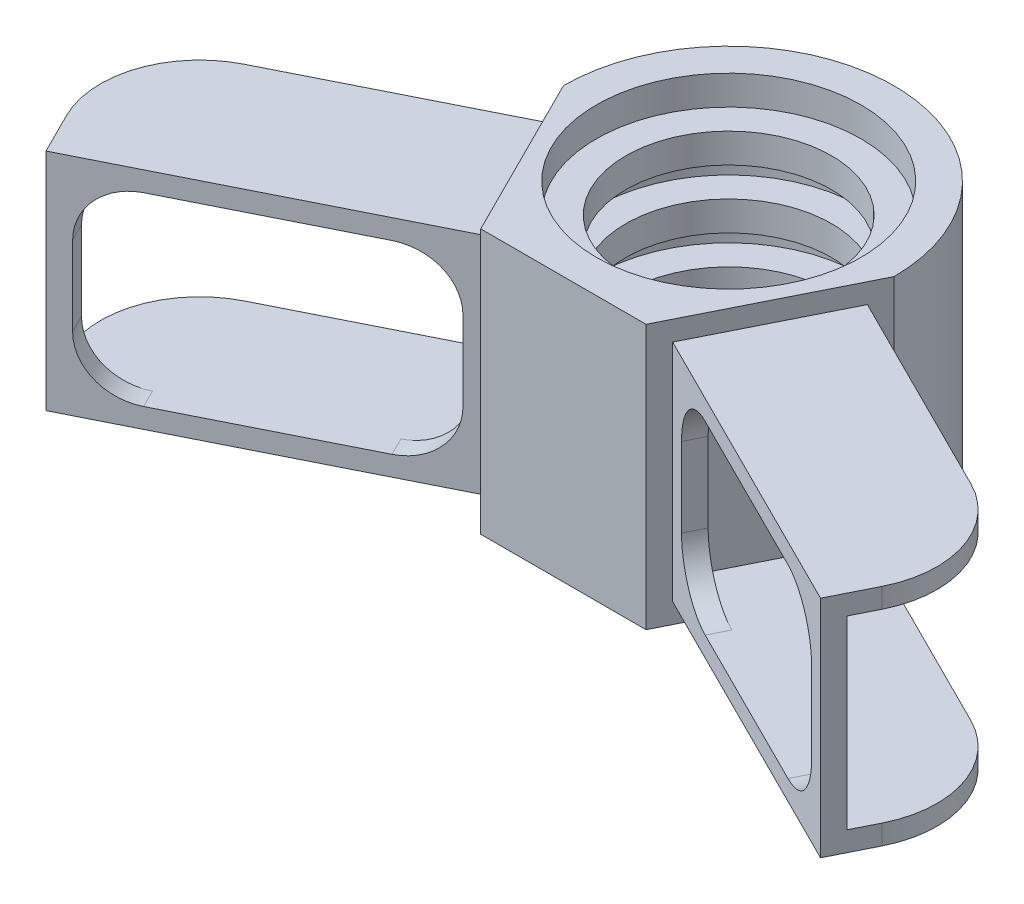
from build123d import *

# Parameters (mm, degrees)
EXTRUDE_1_DEPTH        = 40
EXTRUDE_2_DEPTH        = 50
FILLET_1_R             = 15
CUT_EXTRUDE_1_DEPTH    = 50
FILLET_1_OF_MIRROR_2_R = 15
SKETCH_4_R             = 20
CUT_EXTRUDE_2_DEPTH    = 4.444444444
SKETCH_5_R             = 15.555555556
CUT_EXTRUDE_3_DEPTH    = 86.214294565
PATTERN_LINEAR_1_COUNT = 5
PATTERN_LINEAR_1_PITCH = 8.888888889


with BuildPart() as part:
    # 草图1 → 凸台-拉伸1 (new body)
    with BuildSketch(Plane(origin=(0, 0, 0), x_dir=(1, 0, 0), z_dir=(0, 1, 0))):
        with BuildLine():
            Line((-25, 0), (-12.5, -25))
            Line((-12.5, -25), (12.5, -25))
            Line((12.5, -25), (25, 0))
            ThreePointArc((25, 0), (0, 25), (-25, 0))
        make_face()
    extrude(amount=EXTRUDE_1_DEPTH)

    # 草图2 → 凸台-拉伸2 (add)
    with BuildSketch(Plane(origin=(20, 0, 10), x_dir=(0.447213595499958, 0, -0.894427190999916), z_dir=(0.894427190999916, 0, 0.447213595499958))):
        Polygon((8.180339887, 34), (8.180339887, 37), (-13.770509831, 37), (-13.770509831, 3), (8.180339887, 3), (8.180339887, 6), (-10.770509831, 6), (-10.770509831, 34), align=None)
    extrude_2 = extrude(amount=EXTRUDE_2_DEPTH)

    # 圆角1
    fillet_1_edges = [part.edges().sort_by_distance(p)[0] for p in [
        (68.379718763, 35.5, 25.043961348),
        (68.379718763, 4.5, 25.043961348),
    ]]
    fillet(fillet_1_edges, radius=FILLET_1_R)

    # 草图3 → 切除-拉伸1 (cut)
    with BuildSketch(Plane(origin=(-6.158359214, 0, 12.316718427), x_dir=(0.8944271909999159, 0, 0.44721359549995804), z_dir=(-0.44721359549995804, 0, 0.8944271909999159))):
        with BuildLine():
            Line((25.360679775, 26), (25.360679775, 14))
            ThreePointArc((25.360679775, 14), (27.703825526, 8.343145751), (33.360679775, 6))
            Line((33.360679775, 6), (61.360679775, 6))
            ThreePointArc((61.360679775, 6), (67.017534024, 8.343145751), (69.360679775, 14))
            Line((69.360679775, 14), (69.360679775, 26))
            ThreePointArc((69.360679775, 26), (67.017534024, 31.656854249), (61.360679775, 34))
            Line((61.360679775, 34), (33.360679775, 34))
            ThreePointArc((33.360679775, 34), (27.703825526, 31.656854249), (25.360679775, 26))
        make_face()
    cut_extrude_1 = extrude(amount=-CUT_EXTRUDE_1_DEPTH, mode=Mode.SUBTRACT)

    # 镜向2: 凸台-拉伸2, 切除-拉伸1 across plane
    add(extrude_2.mirror(Plane(origin=(0, 0, 0), x_dir=(0, 0, 1), z_dir=(1, 0, 0))))
    add(cut_extrude_1.mirror(Plane(origin=(0, 0, 0), x_dir=(0, 0, 1), z_dir=(1, 0, 0))), mode=Mode.SUBTRACT)

    # 圆角1 of 镜向2
    fillet_1_of_mirror_2_edges = [part.edges().sort_by_distance(p)[0] for p in [
        (-68.379718763, 35.5, 25.043961348),
        (-68.379718763, 4.5, 25.043961348),
    ]]
    fillet(fillet_1_of_mirror_2_edges, radius=FILLET_1_OF_MIRROR_2_R)

    # 草图4 → 切除-拉伸2 (cut)
    with BuildSketch(Plane(origin=(0, 40, 0), x_dir=(1, 0, 0), z_dir=(0, 1, 0))):
        with Locations(Location((0, 0, 0), (0, 0, 270))):
            Circle(SKETCH_4_R)
    cut_extrude_2 = extrude(amount=-CUT_EXTRUDE_2_DEPTH, mode=Mode.SUBTRACT)

    # 草图5 → 切除-拉伸3 (cut, through all)
    with BuildSketch(Plane(origin=(0, 35.555555556, 0), x_dir=(1, 0, 0), z_dir=(0, 1, 0))):
        with Locations(Location((0, 0, 0), (0, 0, 270))):
            Circle(SKETCH_5_R)
    extrude(amount=-CUT_EXTRUDE_3_DEPTH, mode=Mode.SUBTRACT)

    # 阵列(线性)1: 切除-拉伸2 ×5
    with Locations(*[(0, -i * PATTERN_LINEAR_1_PITCH, 0) for i in range(1, PATTERN_LINEAR_1_COUNT)]):
        add(cut_extrude_2, mode=Mode.SUBTRACT)


solid = part.part
